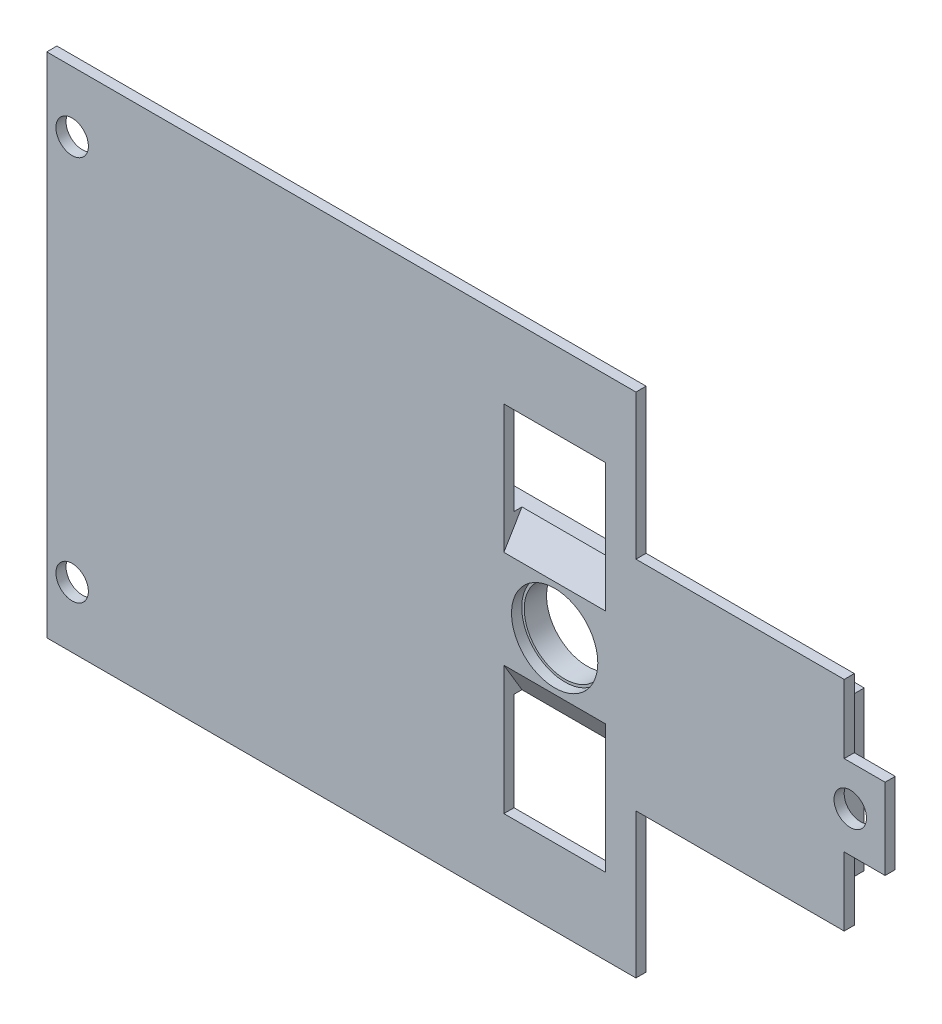
from build123d import *

# Parameters (mm, degrees)
SKETCH4_R           = 1.6
BOSS_EXTRUDE2_DEPTH = 1
BOSS_EXTRUDE3_DEPTH = 2.2
SKETCH6_R           = 4
SKETCH6_W           = 10.008556046
SKETCH6_H           = 9.470821567
CUT_EXTRUDE1_DEPTH  = 57.031418446
CUT_EXTRUDE2_DEPTH  = 10.008556046
SKETCH8_W           = 2.5
SKETCH8_H           = 24.6
BOSS_EXTRUDE4_DEPTH = 10
CUT_EXTRUDE3_REACH  = 89.157
SKETCH10_R          = 4.25
CUT_EXTRUDE4_DEPTH  = 1


with BuildPart() as part:
    # Sketch4 → Boss-Extrude2 (new body)
    with BuildSketch(Plane.XY):
        Polygon((-50.042780229, 25), (8.006844837, 25), (8.006844837, 10.737807635), (28.52438473, 10.737807635), (28.52438473, 3.982032304), (32.555371359, 3.982032304), (32.555371359, -3.982032304), (28.52438473, -3.982032304), (28.52438473, -10.737807635), (8.006844837, -10.737807635), (8.006844837, -25), (-50.042780229, -25), align=None)
        with Locations((-47.542780229, 19)):
            Circle(SKETCH4_R, mode=Mode.SUBTRACT)
        with Locations(Location((-47.542780229, -19, 0), (0, 0, 180))):
            Circle(SKETCH4_R, mode=Mode.SUBTRACT)
        with Locations((29.123529126, 0)):
            Circle(SKETCH4_R, mode=Mode.SUBTRACT)
    extrude(amount=BOSS_EXTRUDE2_DEPTH)

    # Sketch5 → Boss-Extrude3 (add)
    with BuildSketch(Plane(origin=(0, 0, 0), x_dir=(-1, 0, 0), z_dir=(0, 0, -1))):
        Polygon((10.130686795, 7.8), (-27.3, 7.8), (-27.3, -7.8), (10.130686795, -7.8), (10.416393564, -7.8), (10.416393564, -8), (10.416393564, -25), (42.575341492, -25), (42.575341492, -12.3), (50.042780229, -12.3), (50.042780229, 12.3), (42.575341492, 12.3), (42.575341492, 22.8), (10.416393564, 22.8), (10.416393564, 8), (10.416393564, 7.8), align=None)
    extrude(amount=BOSS_EXTRUDE3_DEPTH)

    # Sketch6 → Cut-Extrude1 (cut, through all)
    with BuildSketch(Plane.XY.offset(1)):
        Circle(SKETCH6_R)
        with Locations((0, -12.74225562)):
            Rectangle(SKETCH6_W, SKETCH6_H)
        with Locations((0, 12.74225562)):
            Rectangle(SKETCH6_W, SKETCH6_H)
    extrude(amount=-CUT_EXTRUDE1_DEPTH, mode=Mode.SUBTRACT)

    # Sketch7 → Cut-Extrude2 (cut)
    with BuildSketch(Plane(origin=(-5.004278023, 0, 0), x_dir=(0, 0, -1), z_dir=(1, 0, 0))):
        Polygon((0.904413332, -8.006844837), (-1, -4.814198104), (-1, -8.006844837), (0, -8.006844837), align=None)
    cut_extrude2 = extrude(amount=CUT_EXTRUDE2_DEPTH, mode=Mode.SUBTRACT)

    # Mirror1: Cut-Extrude2 across plane
    add(cut_extrude2.mirror(Plane.ZX), mode=Mode.SUBTRACT)

    # Sketch8 → Boss-Extrude4 (add)
    with BuildSketch(Plane(origin=(0, 0, -2.2), x_dir=(-1, 0, 0), z_dir=(0, 0, -1))):
        with Locations((48.792780229, 0)):
            Rectangle(SKETCH8_W, SKETCH8_H)
    extrude(amount=BOSS_EXTRUDE4_DEPTH)

    # Sketch9 → Cut-Extrude3 (cut, up to next)
    with BuildSketch(Plane.ZY.offset(50.042780229), mode=Mode.PRIVATE) as cut_extrude3_sk1:
        with BuildLine():
            Line((-9.2, 9.061272662), (-12.2, 9.061272662))
            Line((-12.2, 9.061272662), (-12.2, 5.087082771))
            Line((-12.2, 5.087082771), (-9.2, 5.087082771))
            ThreePointArc((-9.2, 5.087082771), (-7.212905055, 7.074177716), (-9.2, 9.061272662))
        make_face()
    cut_extrude3_tool1 = extrude(cut_extrude3_sk1.sketch, amount=-CUT_EXTRUDE3_REACH, mode=Mode.PRIVATE) & part.part
    add(cut_extrude3_tool1.solids().sort_by_distance((-50.04278, 7.074178, -9.898105))[0], mode=Mode.SUBTRACT)

    # Sketch10 → Cut-Extrude4 (cut)
    with BuildSketch(Plane.XY.offset(1)):
        Circle(SKETCH10_R)
    extrude(amount=-CUT_EXTRUDE4_DEPTH, mode=Mode.SUBTRACT)


solid = part.part
